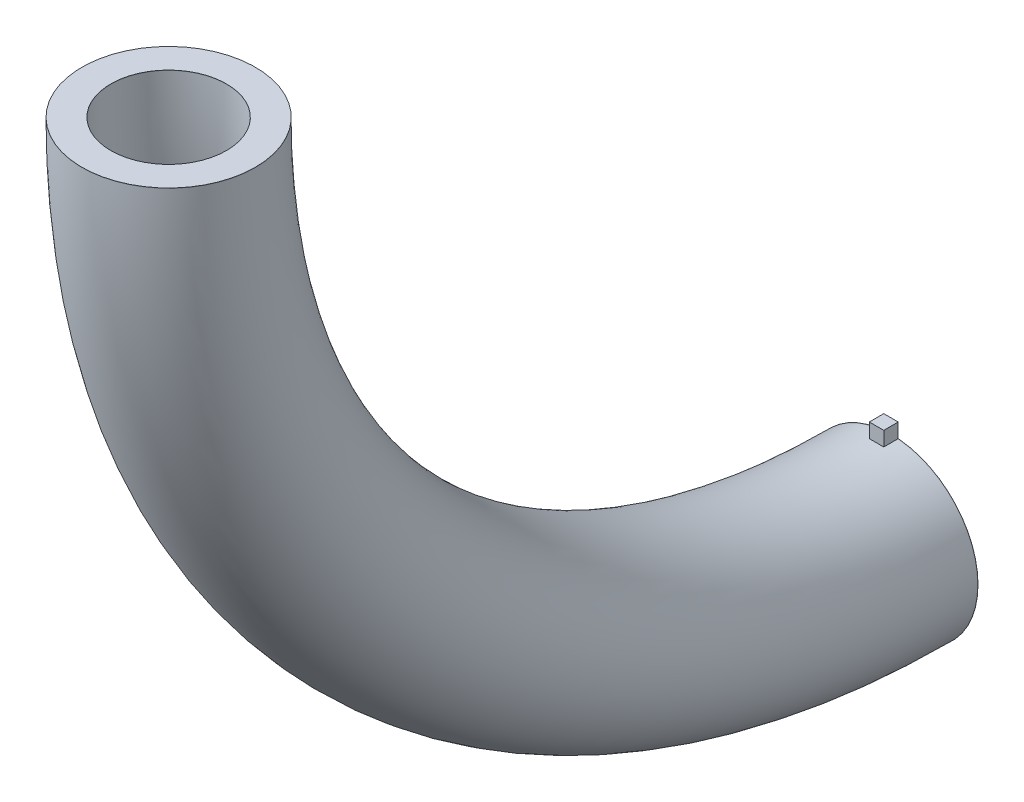
from build123d import *

# Parameters (mm, degrees)
SKETCH1_R           = 3
SKETCH1_R_2         = 2
SKETCH3_W           = 0.5
SKETCH3_H           = 0.5
BOSS_EXTRUDE1_DEPTH = 0.25


with BuildPart() as part:
    # Sweep1: sweep along a path in Sketch2
    with BuildLine(Plane(origin=(0, 0, 0), x_dir=(0, 0, -1), z_dir=(1, 0, 0))) as sweep1_path:
        Line((0, 0), (-0.01, 0))
        ThreePointArc((-0.01, 0), (-17.680598462, 7.319401538), (-25, 24.99))
        Line((-25, 24.99), (-25, 25))
    # Sketch1 → Sweep1 (sweep)
    with BuildSketch(Plane.XY):
        Circle(SKETCH1_R)
        Circle(SKETCH1_R_2, mode=Mode.SUBTRACT)
    sweep(path=sweep1_path.line)

    # Sketch3 → Boss-Extrude1 (add, symmetric)
    with BuildSketch(Plane(origin=(0, 0, 0), x_dir=(0, 0, -1), z_dir=(1, 0, 0))):
        with Locations((-0.26, 3.25)):
            Rectangle(SKETCH3_W, SKETCH3_H)
    extrude(amount=BOSS_EXTRUDE1_DEPTH, both=True)


solid = part.part
